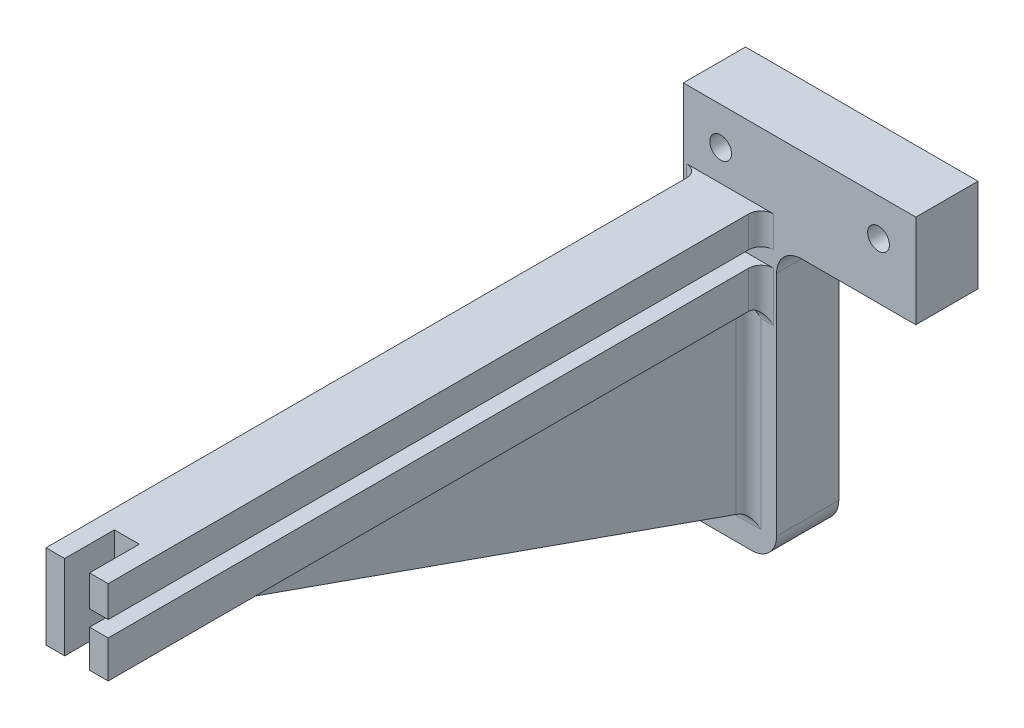
from build123d import *

# Parameters (mm, degrees)
SKETCH1_R           = 1.75
BOSS_EXTRUDE1_DEPTH = 10
BOSS_EXTRUDE2_DEPTH = 105
RIB1_REACH          = 134.949
SKETCH3_WALL_W      = 358.03606807
SKETCH3_WALL_H      = 6
FILLET1_R           = 4
FILLET2_R           = 2
SKETCH4_W           = 4
SKETCH4_H           = 13.56
CUT_EXTRUDE1_DEPTH  = 8


with BuildPart() as part:
    # Sketch1 → Boss-Extrude1 (new body)
    with BuildSketch(Plane.XY):
        Polygon((0, 0), (0, 15), (15, 15), (15, 59.64), (52.39, 59.64), (52.39, 44.64), (30, 44.64), (30, 0), align=None)
        with Locations((6.39, 7.5)):
            Circle(SKETCH1_R, mode=Mode.SUBTRACT)
        with Locations((21, 53.64)):
            Circle(SKETCH1_R, mode=Mode.SUBTRACT)
        with Locations((46.39, 53.64)):
            Circle(SKETCH1_R, mode=Mode.SUBTRACT)
    extrude(amount=BOSS_EXTRUDE1_DEPTH)

    # Sketch2 → Boss-Extrude2 (add)
    with BuildSketch(Plane.XY.offset(10)):
        Polygon((27.5, 48.64), (17.5, 48.64), (17.5, 35.08), (27.5, 35.08), (27.5, 41.08), (22.477989852, 41.08), (22.477989852, 43.64), (27.5, 43.64), align=None)
    extrude(amount=BOSS_EXTRUDE2_DEPTH)

    # Sketch3 wall → Rib1 (add, up to next)
    with BuildSketch(Plane(origin=(22.5, 20.08, 52.5), x_dir=(0, 0.332820117735, 0.942990333583), z_dir=(0, -0.942990333583, 0.332820117735)), mode=Mode.PRIVATE) as rib1_sk1:
        Rectangle(SKETCH3_WALL_W, SKETCH3_WALL_H)
    rib1_tool1 = extrude(rib1_sk1.sketch, amount=-RIB1_REACH, mode=Mode.PRIVATE) - part.part
    add(rib1_tool1.solids().sort_by_distance((22.5, 20.08, 52.5))[0])

    # Fillet1
    fillet1_edges = [part.edges().sort_by_distance(p)[0] for p in [
        (15, 15, 5),
        (30, 44.64, 5),
        (30, 0, 5),
    ]]
    fillet(fillet1_edges, radius=FILLET1_R)

    # Fillet2
    fillet2_edges = [part.edges().sort_by_distance(p)[0] for p in [
        (27.5, 46.14, 10),
        (27.5, 38.08, 10),
        (26.5, 35.08, 10),
        (25.5, 20.08, 10),
        (19.5, 20.08, 10),
        (18.5, 35.08, 10),
        (17.5, 41.86, 10),
        (22.5, 5.08, 10),
    ]]
    fillet(fillet2_edges, radius=FILLET2_R)

    # Sketch4 → Cut-Extrude1 (cut)
    with BuildSketch(Plane.XY.offset(115)):
        with Locations((22.5, 41.86)):
            Rectangle(SKETCH4_W, SKETCH4_H)
    extrude(amount=-CUT_EXTRUDE1_DEPTH, mode=Mode.SUBTRACT)


solid = part.part
